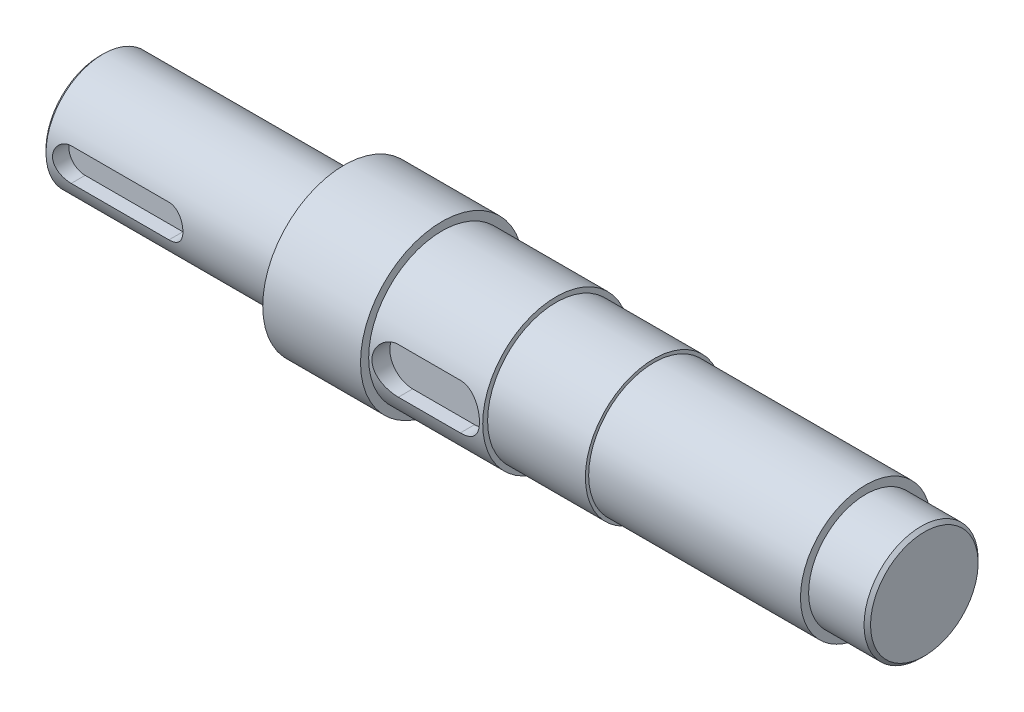
from build123d import *

# Parameters (mm, degrees)
HOLE_WIZARD_M6_1_D     = 5
HOLE_WIZARD_M6_1_DEPTH = 17
HOLE_WIZARD_M6_1_TIP   = 1.502151548
CUT_EXTRUDE_1_DEPTH    = 10
CUT_EXTRUDE_2_DEPTH    = 10
CHAMFER_1_SIZE         = 1


with BuildPart() as part:
    # 草图1 → 旋转1 (revolve)
    with BuildSketch(Plane.XY, mode=Mode.PRIVATE) as revolve_1_sk:
        Polygon((0, 0), (0, 17.5), (45, 17.5), (75, 17.5), (75, 25), (105, 25), (105, 22.5), (140, 22.5), (140, 21), (170, 21), (170, 20), (235, 20), (235, 17.5), (253, 17.5), (253, 0), align=None)
    revolve(revolve_1_sk.sketch.rotate(Axis((0, 0, 0), (1, 0, 0)), 90), axis=Axis((0, 0, 0), (1, 0, 0)))

    # M6 螺纹孔1
    with Locations(Plane(origin=(0, 0, 0), x_dir=(0, 0, -1), z_dir=(-1, 0, 0))):
        with Locations((0, 0)):
            Hole(HOLE_WIZARD_M6_1_D / 2, depth=HOLE_WIZARD_M6_1_DEPTH)
            with Locations((0, 0, -(HOLE_WIZARD_M6_1_DEPTH + HOLE_WIZARD_M6_1_TIP / 2))):  # 118° drill point
                Cone(0, HOLE_WIZARD_M6_1_D / 2, HOLE_WIZARD_M6_1_TIP, mode=Mode.SUBTRACT)

    # 草图4 → 切除-拉伸1 (cut)
    with BuildSketch(Plane.XY.offset(17)):
        with BuildLine():
            Line((113, 7), (132, 7))
            ThreePointArc((132, 7), (139, 0), (132, -7))
            Line((132, -7), (113, -7))
            ThreePointArc((113, -7), (106, 0), (113, 7))
        make_face()
    extrude(amount=CUT_EXTRUDE_1_DEPTH, mode=Mode.SUBTRACT)

    # 草图5 → 切除-拉伸2 (cut)
    with BuildSketch(Plane.XY.offset(12.5)):
        with BuildLine():
            Line((8, 5), (38, 5))
            ThreePointArc((38, 5), (43, 0), (38, -5))
            Line((38, -5), (8, -5))
            ThreePointArc((8, -5), (3, 0), (8, 5))
        make_face()
    extrude(amount=CUT_EXTRUDE_2_DEPTH, mode=Mode.SUBTRACT)

    # 倒角1
    chamfer_1_edges = [part.edges().sort_by_distance(p)[0] for p in [
        (253, 0, -17.5),
        (0, 0, -17.5),
    ]]
    chamfer(chamfer_1_edges, length=CHAMFER_1_SIZE)


solid = part.part
